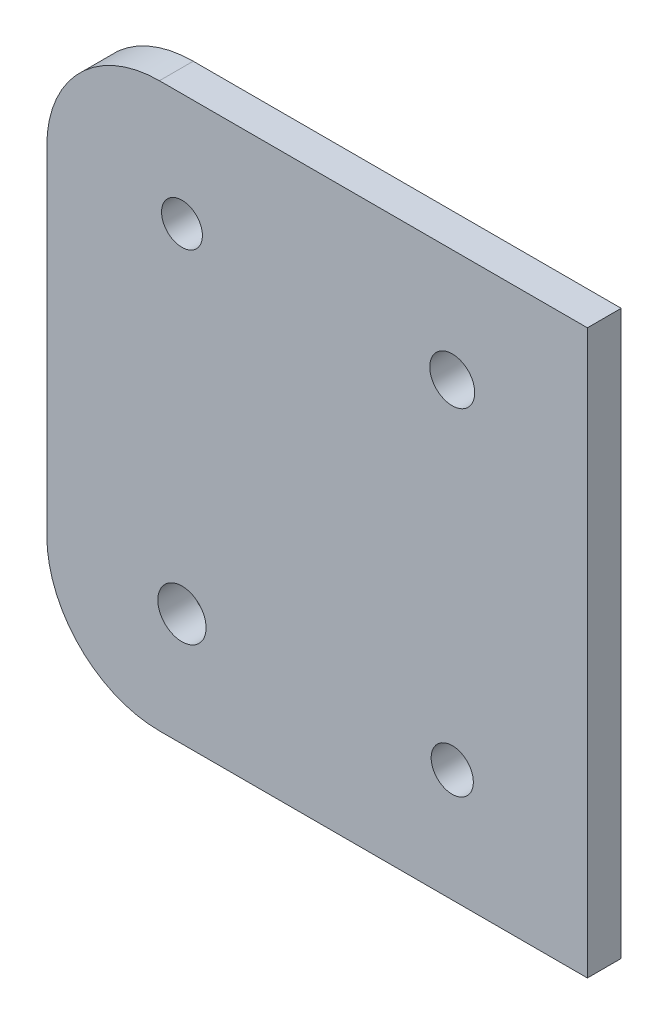
from build123d import *

# Parameters (mm, degrees)
SKETCH1_R           = 1.814467449
SKETCH1_R_2         = 1.995778983
SKETCH1_R_3         = 2.141873052
SKETCH1_R_4         = 1.87301365
BOSS_EXTRUDE1_DEPTH = 3


with BuildPart() as part:
    # Sketch1 → Boss-Extrude1 (new body)
    with BuildSketch(Plane.XY):
        with BuildLine():
            Line((-13.324675325, 14.623376623), (24.675324675, 14.623376623))
            Line((24.675324675, 14.623376623), (24.675324675, -35.376623377))
            Line((24.675324675, -35.376623377), (-13.324675325, -35.376623377))
            ThreePointArc((-13.324675325, -35.376623377), (-20.395743137, -32.447691188), (-23.324675325, -25.376623377))
            Line((-23.324675325, -25.376623377), (-23.324675325, 4.623376623))
            ThreePointArc((-23.324675325, 4.623376623), (-20.395743137, 11.694444435), (-13.324675325, 14.623376623))
        make_face()
        with Locations((-11.324675325, 4.623376623)):
            Circle(SKETCH1_R, mode=Mode.SUBTRACT)
        with Locations((12.675324675, 4.623376623)):
            Circle(SKETCH1_R_2, mode=Mode.SUBTRACT)
        with Locations((-11.324675325, -25.376623377)):
            Circle(SKETCH1_R_3, mode=Mode.SUBTRACT)
        with Locations((12.675324675, -25.376623377)):
            Circle(SKETCH1_R_4, mode=Mode.SUBTRACT)
    extrude(amount=BOSS_EXTRUDE1_DEPTH)


solid = part.part
